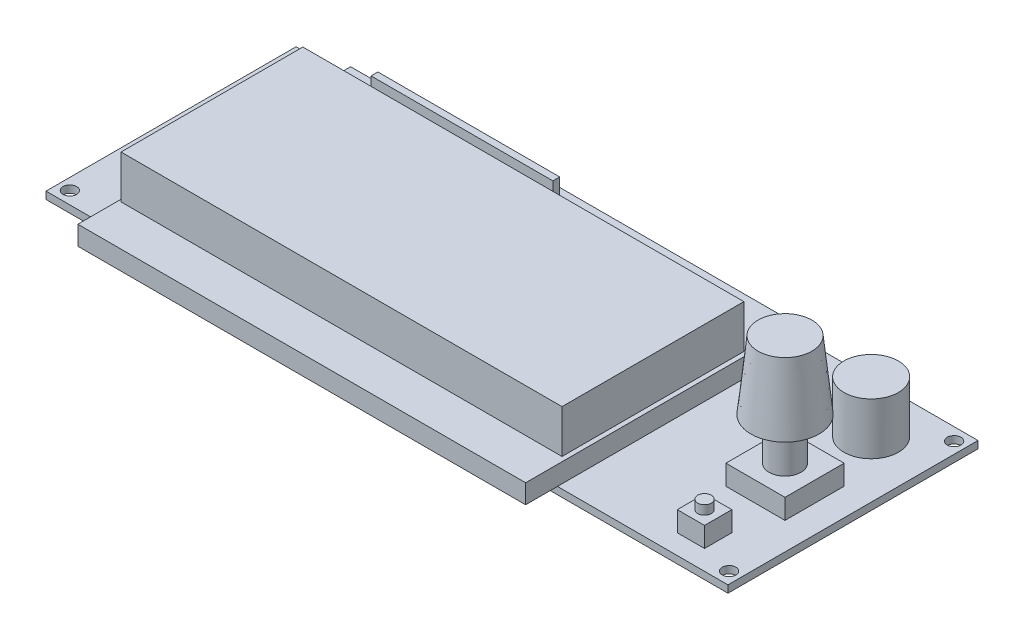
from build123d import *

# Parameters (mm, degrees)
SKETCH1_W                  = 150
SKETCH1_H                  = 55
MAINPCB_DEPTH              = 1.6
SKETCH2_R                  = 1.5
SCREWHOLES_DEPTH           = 80.898748426
SKETCH3_W                  = 98.5
SKETCH3_H                  = 60
BOSS_EXTRUDE2_DEPTH        = 4.2
SKETCH4_W                  = 97
SKETCH4_H                  = 40
BOSS_EXTRUDE3_DEPTH        = 9.5
SKETCH5_R                  = 6
SKETCH5_W                  = 13
SKETCH5_H                  = 13
SKETCH5_W_2                = 6
SKETCH5_H_2                = 6
BOSS_EXTRUDE4_DEPTH        = 4.4
SKETCH6_R                  = 1.5
BOSS_EXTRUDE5_DEPTH        = 2
SKETCH7_R                  = 6
BOSS_EXTRUDE6_DEPTH        = 7
SKETCH8_R                  = 3.5
BOSS_EXTRUDE7_DEPTH        = 9.3
SKETCH9_R                  = 7.5
BOSS_EXTRUDE8_DEPTH        = 15
BOSS_EXTRUDE8_TAPER        = 6
SKETCH10_W                 = 40
SKETCH10_H                 = 1.5
ANNOYINGLYPLACEDPINS_DEPTH = 5


with BuildPart() as part:
    # Sketch1 → MainPCB (new body)
    with BuildSketch(Plane(origin=(0, 0, 0), x_dir=(1, 0, 0), z_dir=(0, 1, 0))):
        Rectangle(SKETCH1_W, SKETCH1_H)
    extrude(amount=MAINPCB_DEPTH)

    # Sketch2 → ScrewHoles (cut, through all)
    with BuildSketch(Plane(origin=(0, 1.6, 0), x_dir=(1, 0, 0), z_dir=(0, 1, 0))):
        with Locations(Location((-72.5, 24.75, 0), (0, 0, 270))):
            Circle(SKETCH2_R)
        with Locations(Location((-72.5, -24.75, 0), (0, 0, 90))):
            Circle(SKETCH2_R)
        with Locations(Location((72.5, -24.75, 0), (0, 0, 270))):
            Circle(SKETCH2_R)
        with Locations(Location((72.5, 24.75, 0), (0, 0, 90))):
            Circle(SKETCH2_R)
    extrude(amount=-SCREWHOLES_DEPTH, mode=Mode.SUBTRACT)

    # Sketch3 → Boss-Extrude2 (add)
    with BuildSketch(Plane(origin=(0, 1.6, 0), x_dir=(1, 0, 0), z_dir=(0, 1, 0))):
        with Locations((-11.75, -4.5)):
            Rectangle(SKETCH3_W, SKETCH3_H)
    extrude(amount=BOSS_EXTRUDE2_DEPTH)

    # Sketch4 → Boss-Extrude3 (add)
    with BuildSketch(Plane(origin=(0, 5.8, 0), x_dir=(1, 0, 0), z_dir=(0, 1, 0))):
        with Locations((-12, -5.5)):
            Rectangle(SKETCH4_W, SKETCH4_H)
    extrude(amount=BOSS_EXTRUDE3_DEPTH)

    # Sketch5 → Boss-Extrude4 (add)
    with BuildSketch(Plane(origin=(0, 1.6, 0), x_dir=(1, 0, 0), z_dir=(0, 1, 0))):
        with Locations(Location((62.5, 16.5, 0), (0, 0, 90))):
            Circle(SKETCH5_R)
        with Locations((62.5, -2.45)):
            Rectangle(SKETCH5_W, SKETCH5_H)
        with Locations((62.5, -20.15)):
            Rectangle(SKETCH5_W_2, SKETCH5_H_2)
    extrude(amount=BOSS_EXTRUDE4_DEPTH)

    # Sketch6 → Boss-Extrude5 (add)
    with BuildSketch(Plane(origin=(0, 6, 0), x_dir=(1, 0, 0), z_dir=(0, 1, 0))):
        with Locations(Location((62.5, -20.15, 0), (0, 0, 270))):
            Circle(SKETCH6_R)
    extrude(amount=BOSS_EXTRUDE5_DEPTH)

    # Sketch7 → Boss-Extrude6 (add)
    with BuildSketch(Plane(origin=(0, 6, 0), x_dir=(1, 0, 0), z_dir=(0, 1, 0))):
        with Locations(Location((62.5, 16.5, 0), (0, 0, 90))):
            Circle(SKETCH7_R)
    extrude(amount=BOSS_EXTRUDE6_DEPTH)

    # Sketch8 → Boss-Extrude7 (add)
    with BuildSketch(Plane(origin=(0, 6, 0), x_dir=(1, 0, 0), z_dir=(0, 1, 0))):
        with Locations(Location((62.5, -2.45, 0), (0, 0, 90))):
            Circle(SKETCH8_R)
    extrude(amount=BOSS_EXTRUDE7_DEPTH)

    # Sketch9 → Boss-Extrude8 (add)
    with BuildSketch(Plane(origin=(0, 15.3, 0), x_dir=(1, 0, 0), z_dir=(0, 1, 0))):
        with Locations((62.5, -2.45)):
            Circle(SKETCH9_R)
    extrude(amount=BOSS_EXTRUDE8_DEPTH, taper=BOSS_EXTRUDE8_TAPER)

    # Sketch10 → AnnoyinglyPlacedPins (add)
    with BuildSketch(Plane(origin=(0, 5.8, 0), x_dir=(1, 0, 0), z_dir=(0, 1, 0))):
        with Locations((-32, 21.75)):
            Rectangle(SKETCH10_W, SKETCH10_H)
    extrude(amount=ANNOYINGLYPLACEDPINS_DEPTH)


solid = part.part
